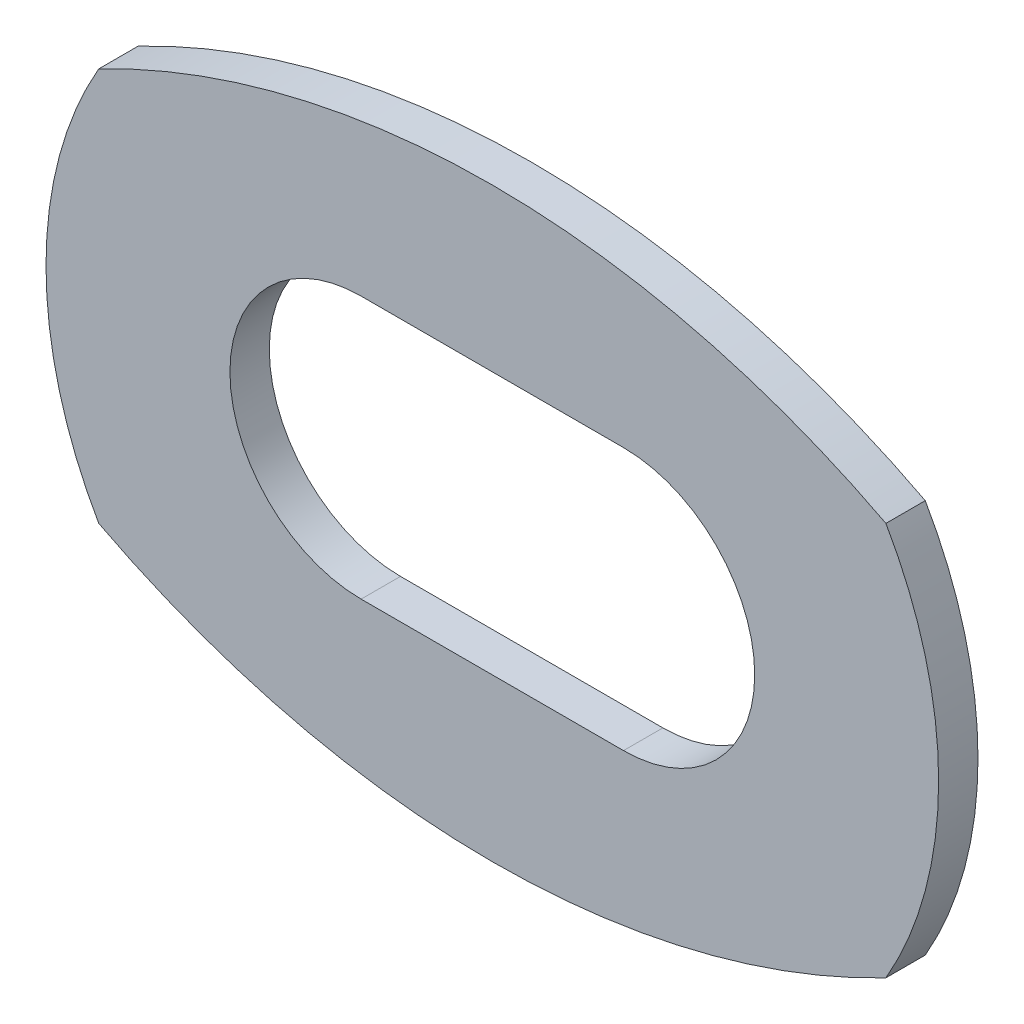
from build123d import *

# Parameters (mm, degrees)
EXTRUDE_1_DEPTH     = 3
CUT_EXTRUDE_1_DEPTH = 56.259583795


with BuildPart() as part:
    # 草图1 → 凸台-拉伸1 (new body)
    with BuildSketch(Plane.XY):
        with BuildLine():
            ThreePointArc((-35.539590168, 31.129951211), (-39.558828054, 16.129951211), (-35.539590168, 1.129951211))
            ThreePointArc((-35.539590168, 1.129951211), (-5.539590168, -6.207235816), (24.460409832, 1.129951211))
            ThreePointArc((24.460409832, 1.129951211), (28.479647718, 16.129951211), (24.460409832, 31.129951211))
            ThreePointArc((24.460409832, 31.129951211), (-5.539590168, 38.467138237), (-35.539590168, 31.129951211))
        make_face()
    extrude(amount=EXTRUDE_1_DEPTH)

    # 草图2 → 切除-拉伸1 (cut, through all)
    with BuildSketch(Plane.XY.offset(3)):
        with BuildLine():
            Line((-15.539590168, 26.129951211), (4.460409832, 26.129951211))
            ThreePointArc((4.460409832, 26.129951211), (14.460409832, 16.129951211), (4.460409832, 6.129951211))
            Line((4.460409832, 6.129951211), (-15.539590168, 6.129951211))
            ThreePointArc((-15.539590168, 6.129951211), (-25.539590168, 16.129951211), (-15.539590168, 26.129951211))
        make_face()
    extrude(amount=-CUT_EXTRUDE_1_DEPTH, mode=Mode.SUBTRACT)


solid = part.part
